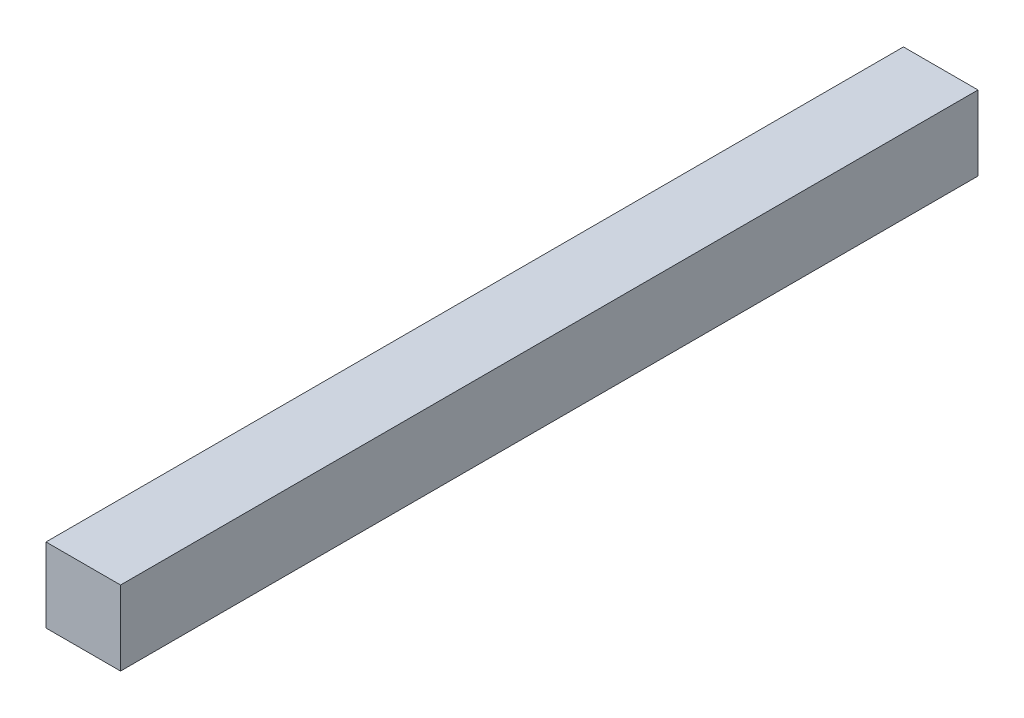
from build123d import *

# Parameters (mm, degrees)
SKETCH1_W           = 20
SKETCH1_H           = 20
BOSS_EXTRUDE1_DEPTH = 230


with BuildPart() as part:
    # Sketch1 → Boss-Extrude1 (new body)
    with BuildSketch(Plane.XY):
        with Locations((10, -10)):
            Rectangle(SKETCH1_W, SKETCH1_H)
    extrude(amount=BOSS_EXTRUDE1_DEPTH)


solid = part.part
